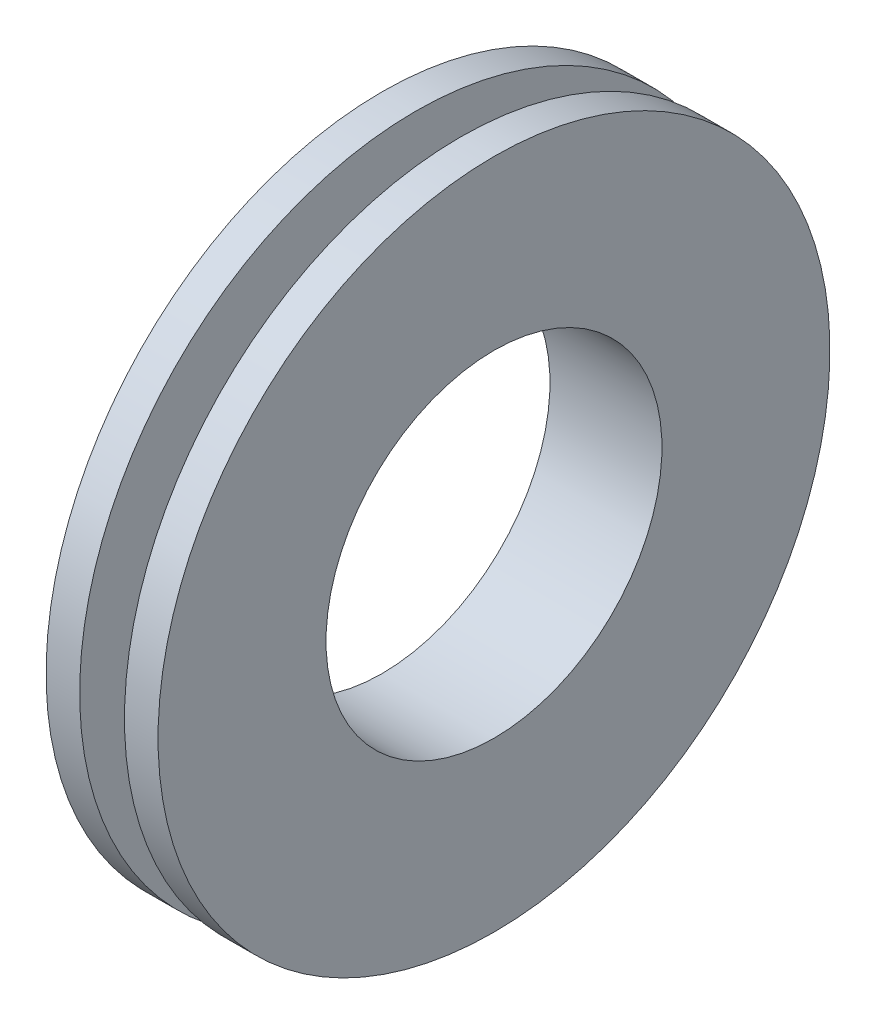
from build123d import *


with BuildPart() as part:
    # Sketch2 → Revolve1 (revolve)
    with BuildSketch(Plane.XY):
        Polygon((0, 15), (-10, 15), (-10, 30), (-7, 30), (-7, 22), (-3, 22), (-3, 30), (0, 30), align=None)
    revolve(axis=Axis((0, 0, 0), (-1, 0, 0)))


solid = part.part
